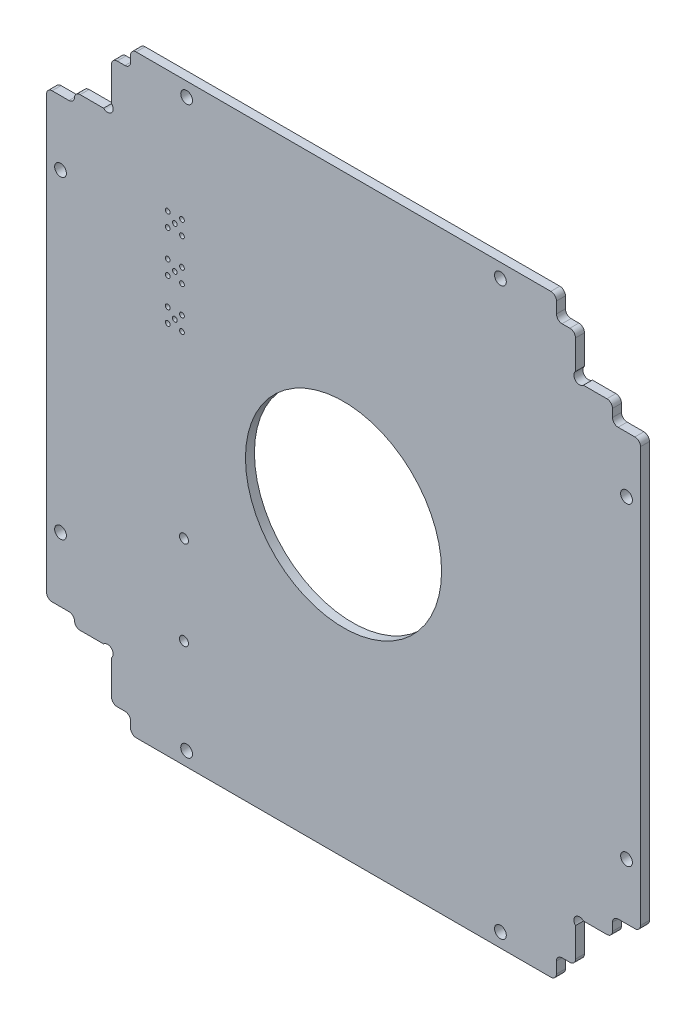
from build123d import *

# Parameters (mm, degrees)
SKETCH1_W            = 106
SKETCH1_H            = 106
MAINOUTLINE_DEPTH    = 1.6
RAILCUTOUTS_DEPTH    = 75.970394157
DOGBONES_DEPTH       = 75.970394157
SOLARFILLETS_DEPTH   = 75.970394157
HANDLINGFILLETS_R    = 1
SKETCH7_R            = 0.8
SKETCH7_R_2          = 0.425
CONNECTORHOLES_DEPTH = 75.9703943
M2_CLEARANCE_HOLE1_D = 2.1
SKETCH10_R           = 17.5
CUT_EXTRUDE1_DEPTH   = 75.9703943


with BuildPart() as part:
    # Sketch1 → mainOutline (new body)
    with BuildSketch(Plane.XY):
        Rectangle(SKETCH1_W, SKETCH1_H)
    extrude(amount=MAINOUTLINE_DEPTH)

    # Sketch4 → railCutouts (cut, through all)
    with BuildSketch(Plane(origin=(0, 0, 0), x_dir=(-1, 0, 0), z_dir=(0, 0, -1))):
        Polygon((-41.4, -41.4), (-48, -41.4), (-48, -39), (-49.9975, -39), (-60.106513243, -39), (-60.106513243, -61.452099286), (-39, -61.452099286), (-39, -49.9), (-39, -49), (-41.4, -49), align=None)
        Polygon((39, -56.27525328), (39, -49.9), (41.4, -49.9), (41.4, -41.4), (48, -41.4), (48, -40.5), (55.517672261, -40.5), (55.517672261, -56.27525328), align=None)
        Polygon((55.383846757, 40.5), (48, 40.5), (48, 41.4), (41.4, 41.4), (41.4, 49.9), (39, 49.9), (39, 57.687687567), (55.383846757, 57.687687567), align=None)
        Polygon((-39, 59.880423019), (-39, 49.9), (-39, 49), (-41.4, 49), (-41.4, 41.4), (-48, 41.4), (-48, 39), (-49.9975, 39), (-56.842822937, 39), (-56.842822937, 59.880423019), align=None)
    extrude(amount=-RAILCUTOUTS_DEPTH, mode=Mode.SUBTRACT)

    # Sketch5 → dogbones (cut, through all)
    with BuildSketch(Plane(origin=(0, 0, 0), x_dir=(-1, 0, 0), z_dir=(0, 0, -1))):
        with BuildLine():
            Line((-41.4, -42.814213562), (-44.73741596, -46.151629522))
            ThreePointArc((-44.73741596, -46.151629522), (-46.151629522, -46.151629522), (-46.151629522, -44.73741596))
            Line((-46.151629522, -44.73741596), (-42.814213562, -41.4))
            ThreePointArc((-42.814213562, -41.4), (-41.4, -41.4), (-41.4, -42.814213562))
        make_face()
        with BuildLine():
            Line((42.814213562, -41.4), (44.747298889, -43.333085326))
            ThreePointArc((44.747298889, -43.333085326), (44.747298889, -44.747298889), (43.333085326, -44.747298889))
            Line((43.333085326, -44.747298889), (41.4, -42.814213562))
            ThreePointArc((41.4, -42.814213562), (41.4, -41.4), (42.814213562, -41.4))
        make_face()
        with BuildLine():
            Line((41.4, 42.814213562), (43.321909081, 44.736122643))
            ThreePointArc((43.321909081, 44.736122643), (44.736122643, 44.736122643), (44.736122643, 43.321909081))
            Line((44.736122643, 43.321909081), (42.814213562, 41.4))
            ThreePointArc((42.814213562, 41.4), (41.4, 41.4), (41.4, 42.814213562))
        make_face()
        with BuildLine():
            Line((-42.814213562, 41.4), (-44.503927418, 43.089713856))
            ThreePointArc((-44.503927418, 43.089713856), (-44.503927418, 44.503927418), (-43.089713856, 44.503927418))
            Line((-43.089713856, 44.503927418), (-41.4, 42.814213562))
            ThreePointArc((-41.4, 42.814213562), (-41.4, 41.4), (-42.814213562, 41.4))
        make_face()
    extrude(amount=-DOGBONES_DEPTH, mode=Mode.SUBTRACT)

    # Sketch6 → solarFillets (cut, through all)
    with BuildSketch(Plane(origin=(0, 0, 0), x_dir=(-1, 0, 0), z_dir=(0, 0, -1))):
        with BuildLine():
            Line((-40, 50), (-40, 53))
            ThreePointArc((-40, 53), (-39, 54), (-38, 53))
            Line((-38, 53), (-38, 50))
            ThreePointArc((-38, 50), (-39, 49), (-40, 50))
        make_face()
        with BuildLine():
            Line((-49, 38), (-53, 38))
            ThreePointArc((-53, 38), (-54, 39), (-53, 40))
            Line((-53, 40), (-49, 40))
            ThreePointArc((-49, 40), (-48, 39), (-49, 38))
        make_face()
        with BuildLine():
            Line((-49, -40), (-55.214202913, -40))
            ThreePointArc((-55.214202913, -40), (-56.214202913, -39), (-55.214202913, -38))
            Line((-55.214202913, -38), (-49, -38))
            ThreePointArc((-49, -38), (-48, -39), (-49, -40))
        make_face()
        with BuildLine():
            Line((-38, -50), (-38, -53.916094318))
            ThreePointArc((-38, -53.916094318), (-39, -54.916094318), (-40, -53.916094318))
            Line((-40, -53.916094318), (-40, -50))
            ThreePointArc((-40, -50), (-39, -49), (-38, -50))
        make_face()
        with BuildLine():
            Line((40, -50.9), (40, -54.538013421))
            ThreePointArc((40, -54.538013421), (39, -55.538013421), (38, -54.538013421))
            Line((38, -54.538013421), (38, -50.9))
            ThreePointArc((38, -50.9), (39, -49.9), (40, -50.9))
        make_face()
        with BuildLine():
            Line((49, -39.5), (54.202622605, -39.5))
            ThreePointArc((54.202622605, -39.5), (55.202622605, -40.5), (54.202622605, -41.5))
            Line((54.202622605, -41.5), (49, -41.5))
            ThreePointArc((49, -41.5), (48, -40.5), (49, -39.5))
        make_face()
        with BuildLine():
            Line((49, 41.5), (54.556563772, 41.5))
            ThreePointArc((54.556563772, 41.5), (55.556563772, 40.5), (54.556563772, 39.5))
            Line((54.556563772, 39.5), (49, 39.5))
            ThreePointArc((49, 39.5), (48, 40.5), (49, 41.5))
        make_face()
        with BuildLine():
            Line((38, 50.9), (38, 55.828092709))
            ThreePointArc((38, 55.828092709), (39, 56.828092709), (40, 55.828092709))
            Line((40, 55.828092709), (40, 50.9))
            ThreePointArc((40, 50.9), (39, 49.9), (38, 50.9))
        make_face()
    extrude(amount=-SOLARFILLETS_DEPTH, mode=Mode.SUBTRACT)

    # handlingFillets
    handlingfillets_edges = [part.edges().sort_by_distance(p)[0] for p in [
        (-41.4, -49.9, 0.8),
        (-38, -53, 0.8),
        (-53, -39.5, 0.8),
        (-48, -41.4, 0.8),
        (-48, 41.4, 0.8),
        (-53, 39.5, 0.8),
        (-41.4, 49.9, 0.8),
        (-38, 53, 0.8),
        (38, 53, 0.8),
        (41.4, 49, 0.8),
        (48, 41.4, 0.8),
        (53, 38, 0.8),
        (53, -38, 0.8),
        (48, -41.4, 0.8),
        (41.4, -49, 0.8),
        (38, -53, 0.8),
    ]]
    fillet(handlingfillets_edges, radius=HANDLINGFILLETS_R)

    # Sketch7 → connectorHoles (cut, through all)
    with BuildSketch(Plane.XY.offset(1.6)):
        with Locations((-28.472296419, -17.925)):
            Circle(SKETCH7_R)
        with Locations((-28.472296419, -33.775)):
            Circle(SKETCH7_R)
        with Locations((-31.37, 28.67)):
            Circle(SKETCH7_R_2)
        with Locations((-28.83, 28.67)):
            Circle(SKETCH7_R_2)
        with Locations((-30.1, 29.94)):
            Circle(SKETCH7_R_2)
        with Locations((-28.83, 31.21)):
            Circle(SKETCH7_R_2)
        with Locations((-31.37, 31.21)):
            Circle(SKETCH7_R_2)
        with Locations((-31.37, 21.27)):
            Circle(SKETCH7_R_2)
        with Locations((-28.83, 21.27)):
            Circle(SKETCH7_R_2)
        with Locations((-30.1, 22.54)):
            Circle(SKETCH7_R_2)
        with Locations((-28.83, 23.81)):
            Circle(SKETCH7_R_2)
        with Locations((-31.37, 23.81)):
            Circle(SKETCH7_R_2)
        with Locations((-31.37, 13.87)):
            Circle(SKETCH7_R_2)
        with Locations((-28.83, 13.87)):
            Circle(SKETCH7_R_2)
        with Locations((-30.1, 15.14)):
            Circle(SKETCH7_R_2)
        with Locations((-28.83, 16.41)):
            Circle(SKETCH7_R_2)
        with Locations((-31.37, 16.41)):
            Circle(SKETCH7_R_2)
    extrude(amount=-CONNECTORHOLES_DEPTH, mode=Mode.SUBTRACT)

    # M2 Clearance Hole1 (through all)
    with Locations(Plane(origin=(0, 0, 0), x_dir=(-1, 0, 0), z_dir=(0, 0, -1))):
        with Locations((50.5, -28), (28, -50.5), (-50.5, -28), (-28, -50.5), (-28, 50.5), (-50.5, 28), (28, 50.5), (50.5, 28)):
            Hole(M2_CLEARANCE_HOLE1_D / 2)

    # Sketch10 → Cut-Extrude1 (cut, through all)
    with BuildSketch(Plane(origin=(0, 0, 0), x_dir=(-1, 0, 0), z_dir=(0, 0, -1))):
        Circle(SKETCH10_R)
    extrude(amount=-CUT_EXTRUDE1_DEPTH, mode=Mode.SUBTRACT)


solid = part.part
